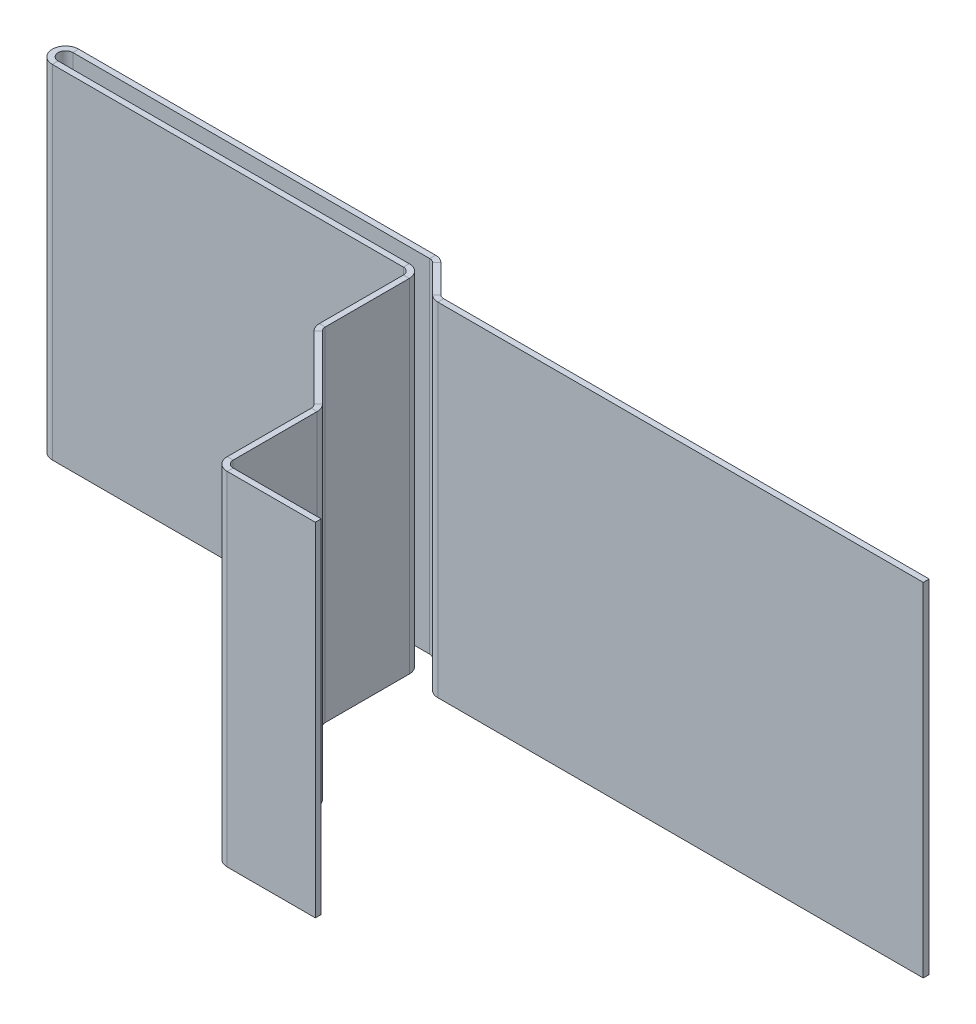
from build123d import *

# Parameters (mm, degrees)
SKETCH1_W          = 70
SKETCH1_H          = 1.2
SKETCH4_W          = 70
SKETCH4_H          = 1.2
CUT_EXTRUDE3_DEPTH = 900


with BuildPart() as part:
    # Sweep1: sweep along a path in Sketch2
    with BuildLine(Plane(origin=(0, 0, 0), x_dir=(-1, 0, 0), z_dir=(0, 1, 0))) as sweep1_path:
        Line((0, 0), (999.171572875, 0))
        ThreePointArc((999.171572875, 0), (999.93693974, -0.152240935), (1000.585786438, -0.585786438))
        Line((1000.585786438, -0.585786438), (1006.290281407, -6.290281407))
        ThreePointArc((1006.290281407, -6.290281407), (1006.939128104, -6.723826909), (1007.704494969, -6.876067844))
        Line((1007.704494969, -6.876067844), (1080.606989687, -6.876067844))
        ThreePointArc((1080.606989687, -6.876067844), (1082.706989687, -4.776067844), (1080.606989687, -2.676067844))
        Line((1080.606989687, -2.676067844), (1008.876067844, -2.676067844))
        ThreePointArc((1008.876067844, -2.676067844), (1007.461854282, -2.090281407), (1006.876067844, -0.676067844))
        Line((1006.876067844, -0.676067844), (1006.876067844, 16.495505031))
        ThreePointArc((1006.876067844, 16.495505031), (1006.723826909, 17.260871896), (1006.290281407, 17.909718593))
        Line((1006.290281407, 17.909718593), (993.319718658, 30.880281342))
        ThreePointArc((993.319718658, 30.880281342), (992.886173156, 31.529128039), (992.733932221, 32.294494904))
        Line((992.733932221, 32.294494904), (992.733932221, 49.466067779))
        ThreePointArc((992.733932221, 49.466067779), (992.148145783, 50.880281342), (990.733932221, 51.466067779))
        Line((990.733932221, 51.466067779), (972.733932221, 51.466067779))
    # Sketch1 → Sweep1 (sweep)
    with BuildSketch(Plane.YZ):
        Rectangle(SKETCH1_W, SKETCH1_H)
    sweep(path=sweep1_path.line)

    # Sketch4 → Cut-Extrude3 (cut)
    with BuildSketch(Plane.YZ):
        Rectangle(SKETCH4_W, SKETCH4_H)
    extrude(amount=-CUT_EXTRUDE3_DEPTH, mode=Mode.SUBTRACT)


solid = part.part
